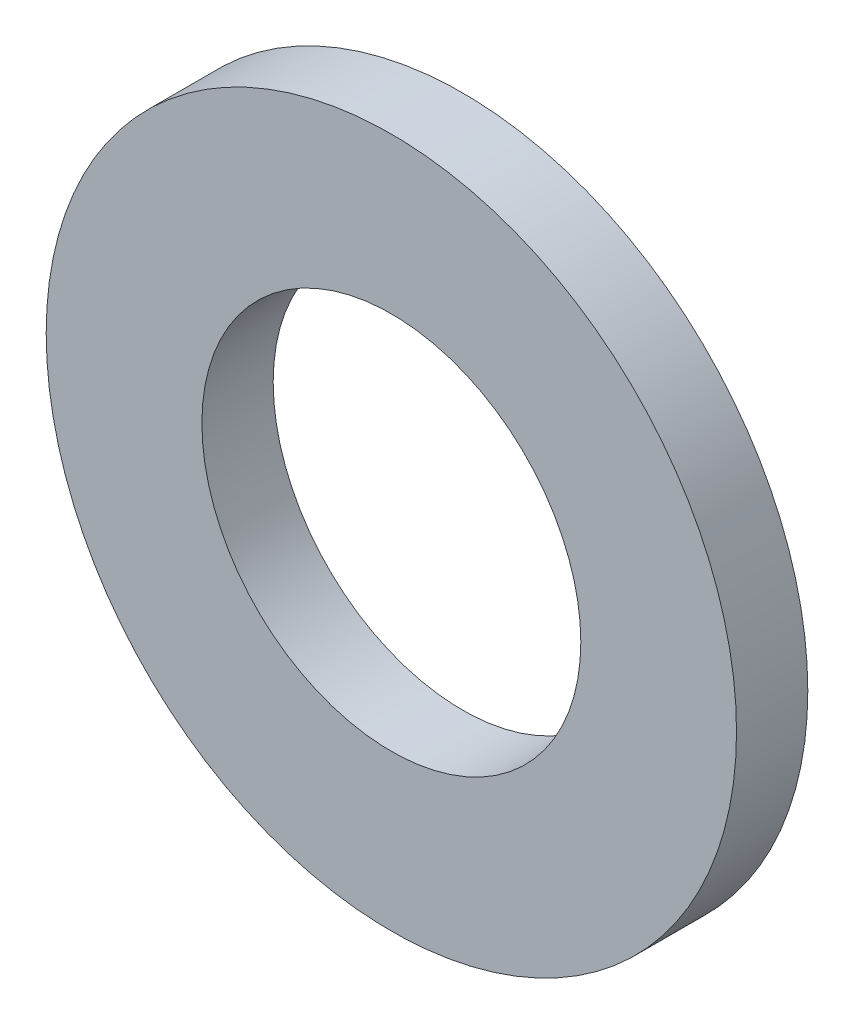
from build123d import *

# Parameters (mm, degrees)
SCHIZZO2_R                   = 2.76
SCHIZZO2_R_2                 = 1.515
ESTRUSIONE_ESTRUSIONE1_DEPTH = 0.57


with BuildPart() as part:
    # Schizzo2 → Estrusione-Estrusione1 (new body)
    with BuildSketch(Plane.XY):
        Circle(SCHIZZO2_R)
        Circle(SCHIZZO2_R_2, mode=Mode.SUBTRACT)
    extrude(amount=ESTRUSIONE_ESTRUSIONE1_DEPTH)


solid = part.part
